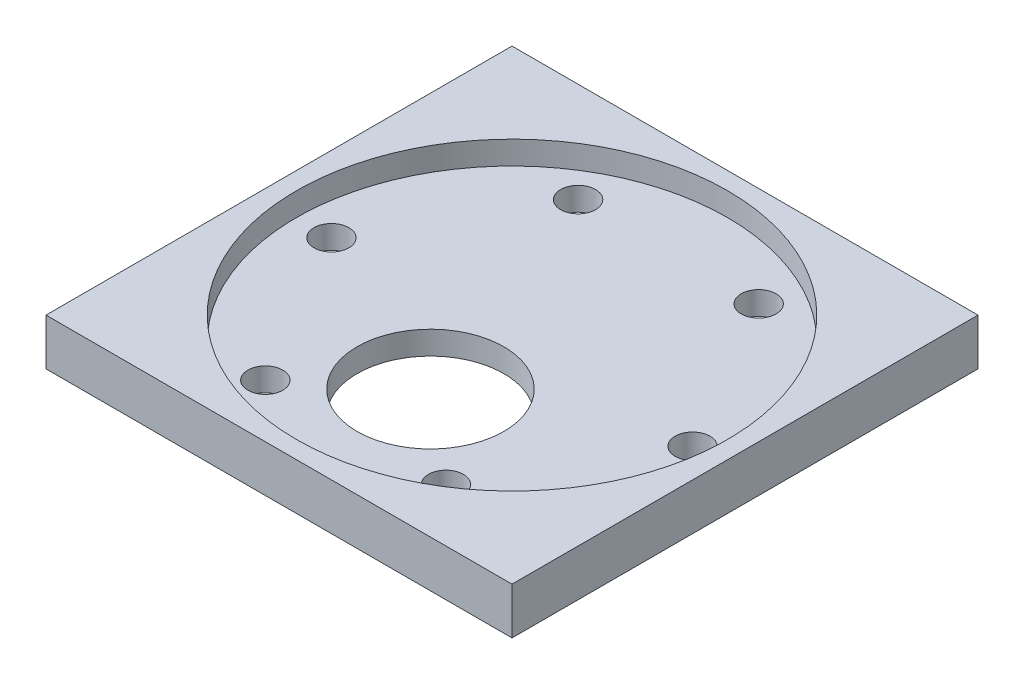
from build123d import *

# Parameters (mm, degrees)
SKETCH1_W           = 40
SKETCH1_H           = 40
BOSS_EXTRUDE1_DEPTH = 4
SKETCH2_R           = 6.3
SKETCH2_R_2         = 1.5
CUT_EXTRUDE2_DEPTH  = 5
SKETCH3_R           = 18.5
CUT_EXTRUDE3_DEPTH  = 2


with BuildPart() as part:
    # Sketch1 → Boss-Extrude1 (new body)
    with BuildSketch(Plane(origin=(0, 0, 0), x_dir=(1, 0, 0), z_dir=(0, 1, 0))):
        Rectangle(SKETCH1_W, SKETCH1_H)
    extrude(amount=BOSS_EXTRUDE1_DEPTH)

    # Sketch2 → Cut-Extrude2 (cut)
    with BuildSketch(Plane(origin=(0, 4, 0), x_dir=(1, 0, 0), z_dir=(0, 1, 0))):
        with Locations(Location((0, -7, 0), (0, 0, 270))):
            Circle(SKETCH2_R)
        with Locations(Location((15.5, 0, 0), (0, 0, 270))):
            Circle(SKETCH2_R_2)
        with Locations(Location((7.75, -13.423393759, 0), (0, 0, 270))):
            Circle(SKETCH2_R_2)
        with Locations(Location((-7.75, -13.423393759, 0), (0, 0, 270))):
            Circle(SKETCH2_R_2)
        with Locations(Location((-15.5, 0, 0), (0, 0, 270))):
            Circle(SKETCH2_R_2)
        with Locations(Location((-7.75, 13.423393759, 0), (0, 0, 270))):
            Circle(SKETCH2_R_2)
        with Locations(Location((7.75, 13.423393759, 0), (0, 0, 270))):
            Circle(SKETCH2_R_2)
    extrude(amount=-CUT_EXTRUDE2_DEPTH, mode=Mode.SUBTRACT)

    # Sketch3 → Cut-Extrude3 (cut)
    with BuildSketch(Plane(origin=(0, 4, 0), x_dir=(1, 0, 0), z_dir=(0, 1, 0))):
        with Locations(Location((0, 0, 0), (0, 0, 270))):
            Circle(SKETCH3_R)
    extrude(amount=-CUT_EXTRUDE3_DEPTH, mode=Mode.SUBTRACT)


solid = part.part
